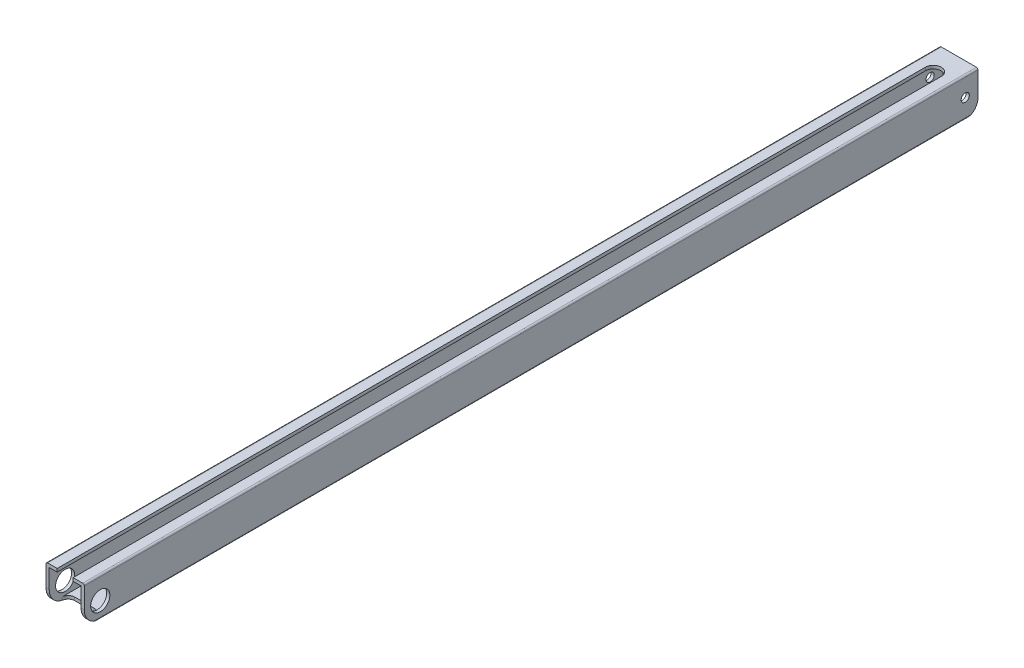
from build123d import *

# Parameters (mm, degrees)
SKETCH3_W           = 19.05
SKETCH3_H           = 19.05
SKETCH3_W_2         = 15.875
SKETCH3_H_2         = 15.875
BOSS_EXTRUDE1_DEPTH = 222.25
FILLET1_R           = 0.79375
CUT_EXTRUDE1_REACH  = 225.268
CUT_EXTRUDE2_REACH  = 225.268
SKETCH5_W           = 15.875
SKETCH5_H           = 9.525
FILLET2_R           = 3.175
CUT_EXTRUDE3_DEPTH  = 224.268203345
SKETCH7_R           = 4.7625
SKETCH7_R_2         = 2.032
CUT_EXTRUDE4_DEPTH  = 224.268203458
CUT_EXTRUDE5_DEPTH  = 224.268203458


with BuildPart() as part:
    # Sketch3 → Boss-Extrude1 (new, symmetric)
    with BuildSketch(Plane.XY):
        Rectangle(SKETCH3_W, SKETCH3_H)
        Rectangle(SKETCH3_W_2, SKETCH3_H_2, mode=Mode.SUBTRACT)
    extrude(amount=BOSS_EXTRUDE1_DEPTH, both=True)

    # Fillet1
    fillet1_edges = [part.edges().sort_by_distance(p)[0] for p in [
        (9.525, -9.525, 0),
        (-9.525, -9.525, 0),
        (-9.525, 9.525, 0),
        (9.525, 9.525, 0),
    ]]
    fillet(fillet1_edges, radius=FILLET1_R)

    # Sketch4 → Cut-Extrude1 (cut, up to next)
    with BuildSketch(Plane(origin=(0, 9.525, 0), x_dir=(1, 0, 0), z_dir=(0, 1, 0)), mode=Mode.PRIVATE) as cut_extrude1_sk1:
        with BuildLine():
            Line((-3.96875, 209.55), (-3.96875, -222.25))
            Line((-3.96875, -222.25), (3.96875, -222.25))
            Line((3.96875, -222.25), (3.96875, 209.55))
            ThreePointArc((3.96875, 209.55), (0, 213.51875), (-3.96875, 209.55))
        make_face()
    cut_extrude1_tool1 = extrude(cut_extrude1_sk1.sketch, amount=-CUT_EXTRUDE1_REACH, mode=Mode.PRIVATE) & part.part
    add(cut_extrude1_tool1.solids().sort_by_distance((0, 9.525, 4.790573))[0], mode=Mode.SUBTRACT)

    # Sketch5 → Cut-Extrude2 (cut, up to next)
    with BuildSketch(Plane(origin=(0, -9.525, 0), x_dir=(-1, 0, 0), z_dir=(0, -1, 0)), mode=Mode.PRIVATE) as cut_extrude2_sk1:
        with Locations((0, -217.4875)):
            Rectangle(SKETCH5_W, SKETCH5_H)
    cut_extrude2_tool1 = extrude(cut_extrude2_sk1.sketch, amount=-CUT_EXTRUDE2_REACH, mode=Mode.PRIVATE) & part.part
    add(cut_extrude2_tool1.solids().sort_by_distance((0, -9.525, 217.4875))[0], mode=Mode.SUBTRACT)

    # Fillet2
    fillet2_edges = [part.edges().sort_by_distance(p)[0] for p in [
        (-7.9375, -8.73125, 212.725),
        (7.9375, -8.73125, 212.725),
    ]]
    fillet(fillet2_edges, radius=FILLET2_R)

    # Sketch6 → Cut-Extrude3 (cut, through all)
    with BuildSketch(Plane(origin=(9.525, 0, 0), x_dir=(0, 0, -1), z_dir=(1, 0, 0))):
        with BuildLine():
            Line((-222.25, -1.5875), (-222.25, -9.525))
            Line((-222.25, -9.525), (-214.3125, -9.525))
            ThreePointArc((-214.3125, -9.525), (-219.925160076, -7.200160076), (-222.25, -1.5875))
        make_face()
    extrude(amount=-CUT_EXTRUDE3_DEPTH, mode=Mode.SUBTRACT)

    # Sketch7 → Cut-Extrude4 (cut, through all)
    with BuildSketch(Plane(origin=(9.525, 0, 0), x_dir=(0, 0, -1), z_dir=(1, 0, 0))):
        with Locations((-214.3125, -1.5875)):
            Circle(SKETCH7_R)
        with Locations((215.9, 0)):
            Circle(SKETCH7_R_2)
    extrude(amount=-CUT_EXTRUDE4_DEPTH, mode=Mode.SUBTRACT)

    # Sketch8 → Cut-Extrude5 (cut, through all)
    with BuildSketch(Plane(origin=(9.525, 0, 0), x_dir=(0, 0, -1), z_dir=(1, 0, 0))):
        with BuildLine():
            Line((215.9, -9.525), (222.25, -9.525))
            Line((222.25, -9.525), (222.25, -3.175))
            ThreePointArc((222.25, -3.175), (220.390128061, -7.665128061), (215.9, -9.525))
        make_face()
    extrude(amount=-CUT_EXTRUDE5_DEPTH, mode=Mode.SUBTRACT)


solid = part.part
